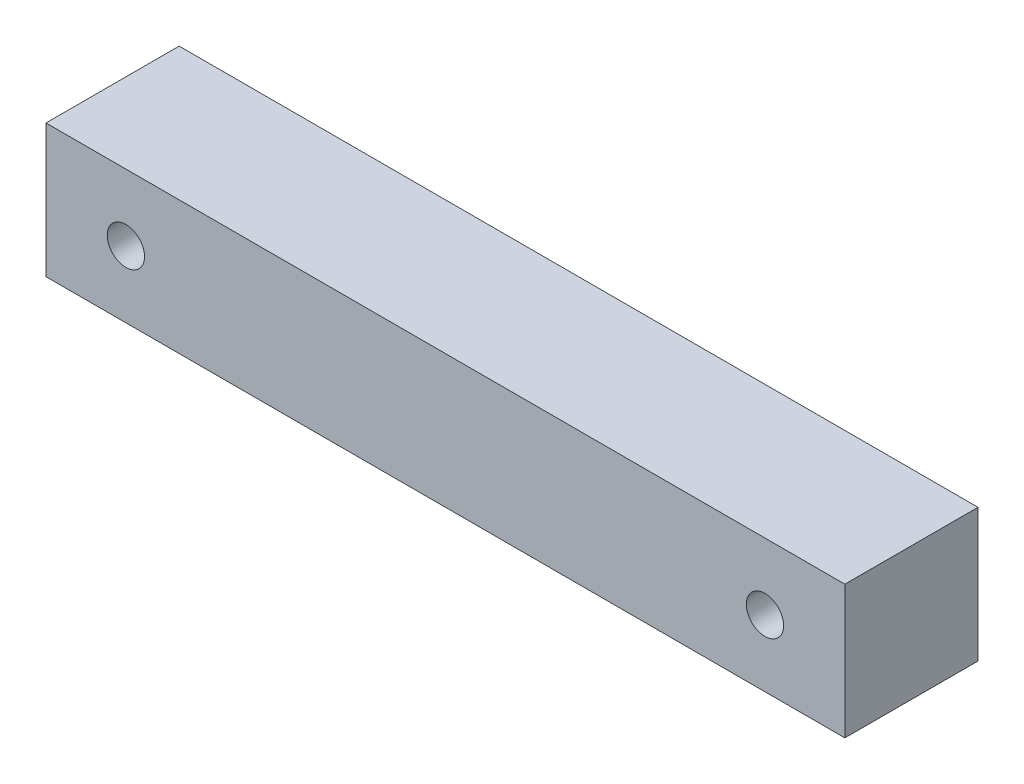
from build123d import *

# Parameters (mm, degrees)
SKETCH_1_W          = 60
SKETCH_1_H          = 10
EXTRUDE_1_DEPTH     = 10
SKETCH_3_R          = 1.4
CUT_EXTRUDE_1_DEPTH = 20


with BuildPart() as part:
    # 草图1 → 凸台-拉伸1 (new body)
    with BuildSketch(Plane(origin=(0, 0, 0), x_dir=(1, 0, 0), z_dir=(0, 1, 0))):
        with Locations((30, 5)):
            Rectangle(SKETCH_1_W, SKETCH_1_H)
    extrude(amount=EXTRUDE_1_DEPTH)

    # 草图3 → 切除-拉伸1 (cut)
    with BuildSketch(Plane.XY):
        with Locations((6, 5)):
            Circle(SKETCH_3_R)
        with Locations((54, 5)):
            Circle(SKETCH_3_R)
    extrude(amount=-CUT_EXTRUDE_1_DEPTH, mode=Mode.SUBTRACT)


solid = part.part
